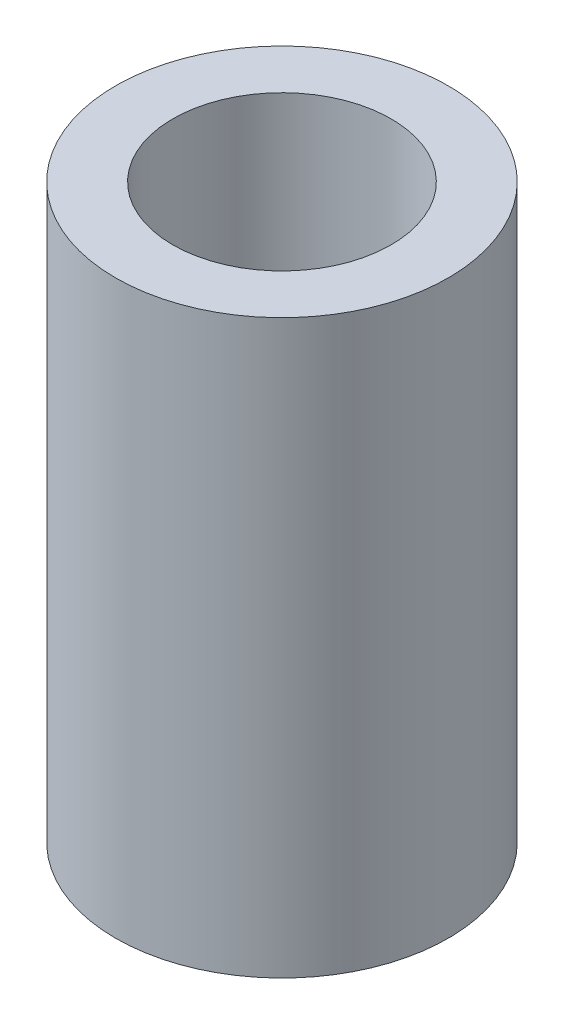
from build123d import *

# Parameters (mm, degrees)
SKETCH1_R           = 4.064
SKETCH1_R_2         = 2.667
BOSS_EXTRUDE1_DEPTH = 13.97


with BuildPart() as part:
    # Sketch1 → Boss-Extrude1 (new body)
    with BuildSketch(Plane(origin=(0, 0, 0), x_dir=(1, 0, 0), z_dir=(0, 1, 0))):
        with Locations(Location((0, 0, 0), (0, 0, 270))):
            Circle(SKETCH1_R)
        with Locations(Location((0, 0, 0), (0, 0, 270))):
            Circle(SKETCH1_R_2, mode=Mode.SUBTRACT)
    extrude(amount=BOSS_EXTRUDE1_DEPTH)


solid = part.part
